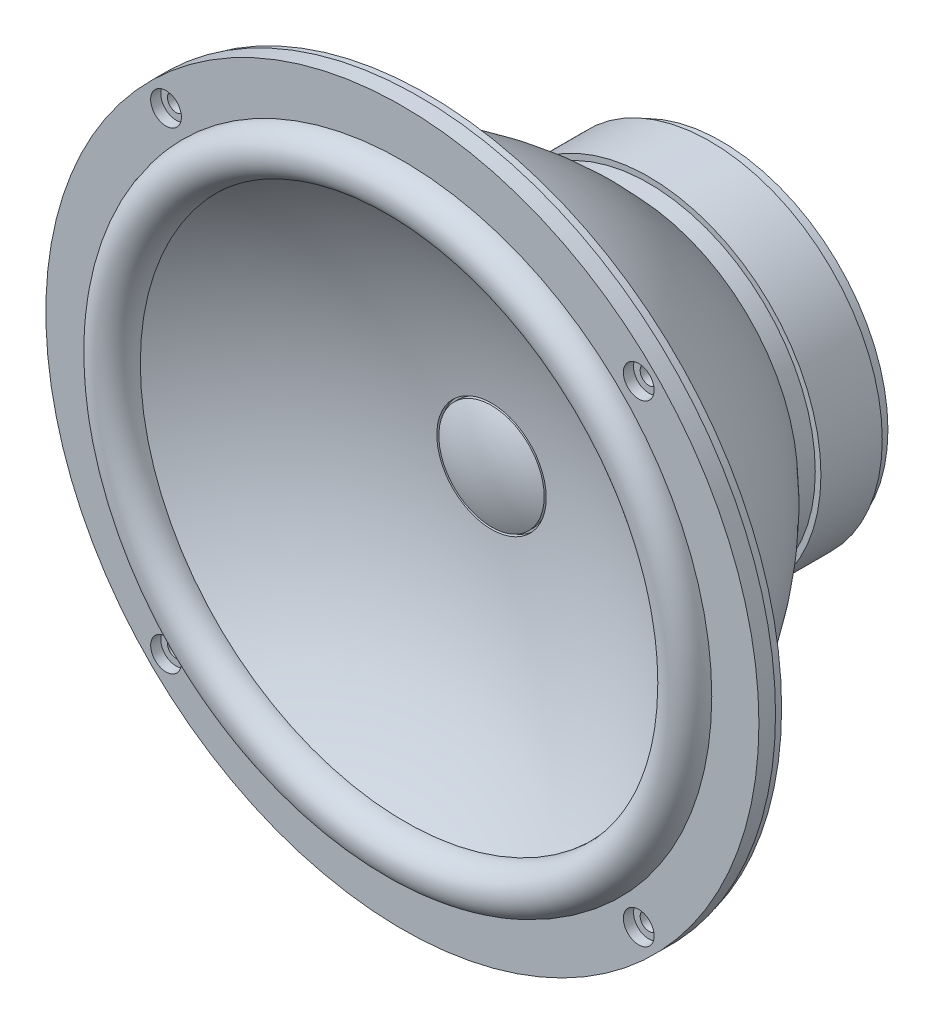
from build123d import *

# Parameters (mm, degrees)
SKETCH3_R          = 2.15
CUT_HOLES_DEPTH    = 152.160973799
SKETCH4_R          = 3.7973
CUT_EXTRUDE4_DEPTH = 2.5019


with BuildPart() as part:
    # Sketch1 → Revolve1 (revolve)
    with BuildSketch(Plane(origin=(0, 0, 0), x_dir=(1, 0, 0), z_dir=(0, 1, 0))):
        with BuildLine():
            Line((76.360050956, 0), (88, 0))
            Line((88, 0), (88, 4.1))
            Line((88, 4.1), (87.5, 4.1))
            Line((87.5, 4.1), (87.5, 6.1))
            Line((87.5, 6.1), (72.25, 6.1))
            ThreePointArc((72.25, 6.1), (60.431927794, 33.612739382), (41.107075762, 56.4856))
            Line((41.107075762, 56.4856), (41.107075762, 60.8036))
            Line((41.107075762, 60.8036), (42.5, 60.8036))
            Line((42.5, 60.8036), (42.5, 75.942))
            Line((42.5, 75.942), (41.107075762, 75.942))
            Line((41.107075762, 75.942), (41.107075762, 78.736))
            ThreePointArc((41.107075762, 78.736), (29.490355709, 81.776565788), (17.526, 82.8))
            Line((17.526, 82.8), (5, 82.8))
            Line((5, 82.8), (5, 83.8))
            Line((5, 83.8), (2, 83.8))
            Line((2, 83.8), (2, 85.8))
            Line((2, 85.8), (0, 85.8))
            Line((0, 85.8), (0, 19.240383034))
            ThreePointArc((0, 19.240383034), (6.644837955, 19.937889067), (13, 22))
            Line((13, 22), (13, 23))
            Line((13, 23), (13.5, 23))
            Line((13.5, 23), (13.5, 22))
            ThreePointArc((13.5, 22), (40.947327355, 15.0380389), (65.342731977, 0.661359359))
            ThreePointArc((65.342731977, 0.661359359), (70.501977385, -5.490068668), (76.360050956, 0))
        make_face()
    revolve(axis=Axis((0, 0, -19.240383034), (0, 0, -1)))

    # Sketch3 → Cut holes (cut, through all)
    with BuildSketch(Plane.XY):
        with Locations((-58.336309448, 58.336309448)):
            Circle(SKETCH3_R)
        with Locations((58.336309448, 58.336309448)):
            Circle(SKETCH3_R)
        with Locations((58.336309448, -58.336309448)):
            Circle(SKETCH3_R)
        with Locations((-58.336309448, -58.336309448)):
            Circle(SKETCH3_R)
    extrude(amount=-CUT_HOLES_DEPTH, mode=Mode.SUBTRACT)

    # Sketch4 → Cut-Extrude4 (cut)
    with BuildSketch(Plane.XY):
        with Locations((-58.336309448, 58.336309448)):
            Circle(SKETCH4_R)
        with Locations((58.336309448, 58.336309448)):
            Circle(SKETCH4_R)
        with Locations((58.336309448, -58.336309448)):
            Circle(SKETCH4_R)
        with Locations((-58.336309448, -58.336309448)):
            Circle(SKETCH4_R)
    extrude(amount=-CUT_EXTRUDE4_DEPTH, mode=Mode.SUBTRACT)


solid = part.part
